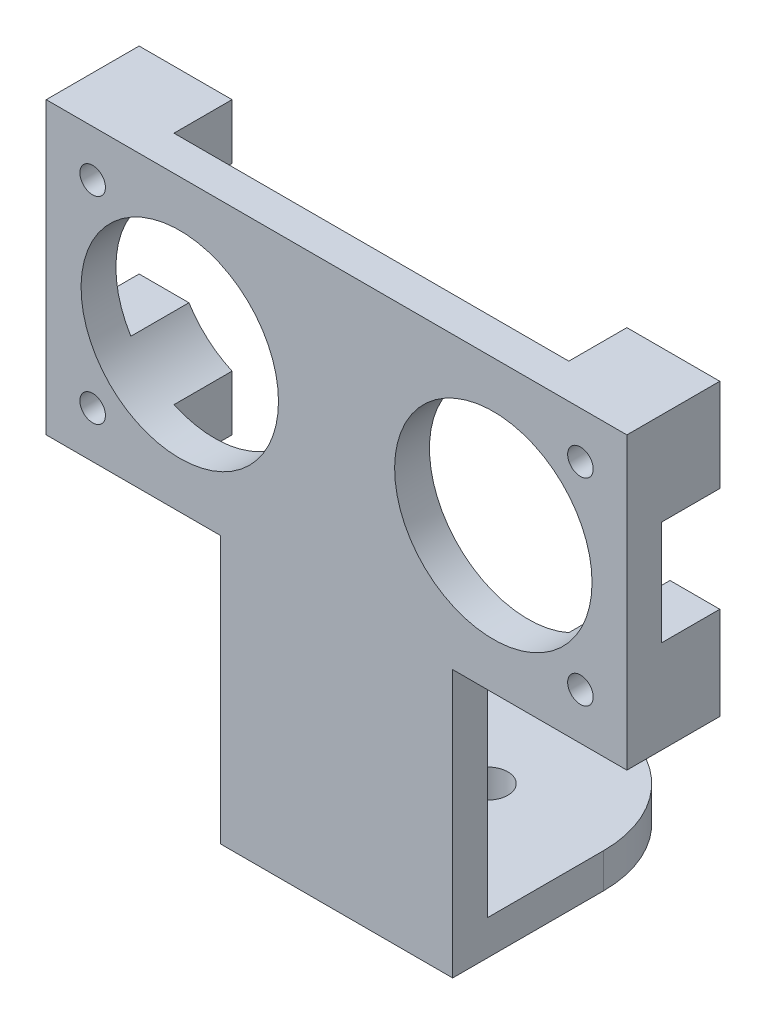
from build123d import *
from build123d.topology import SkipClean

# Parameters (mm, degrees)
SKETCH_1_R      = 8.5
SKETCH_1_R_2    = 1.1
EXTRUDE_1_DEPTH = 3
SKETCH_2_R      = 1.75
EXTRUDE_2_DEPTH = 3
EXTRUDE_START   = 5
SKETCH_5_R      = 1.1
EXTRUDE_3_DEPTH = 5


with BuildPart() as part:
    # 草图1 → 凸台-拉伸1 (new body)
    with BuildSketch(Plane.XY):
        Polygon((-25, 12.5), (25, 12.5), (25, -12.5), (10, -12.5), (10, -32.5), (-10, -32.5), (-10, -12.5), (-25, -12.5), align=None)
        with Locations((-13.5, 0)):
            Circle(SKETCH_1_R, mode=Mode.SUBTRACT)
        with Locations((13.5, 0)):
            Circle(SKETCH_1_R, mode=Mode.SUBTRACT)
        with Locations((-21, 8.5)):
            Circle(SKETCH_1_R_2, mode=Mode.SUBTRACT)
        with Locations((21, 8.5)):
            Circle(SKETCH_1_R_2, mode=Mode.SUBTRACT)
        with Locations((21, -8.5)):
            Circle(SKETCH_1_R_2, mode=Mode.SUBTRACT)
        with Locations((-21, -8.5)):
            Circle(SKETCH_1_R_2, mode=Mode.SUBTRACT)
    extrude(amount=EXTRUDE_1_DEPTH)

    # 草图2 → 凸台-拉伸2 (add)
    with BuildSketch(Plane.XZ.offset(32.5)):
        with BuildLine():
            Line((-10, 3), (-10, -10))
            ThreePointArc((-10, -10), (0, -20), (10, -10))
            Line((10, -10), (10, 3))
            Line((10, 3), (-10, 3))
        make_face()
        with Locations((0, -10)):
            Circle(SKETCH_2_R, mode=Mode.SUBTRACT)
    extrude(amount=EXTRUDE_2_DEPTH)

    # 草图5 → 凸台-拉伸3 (add)
    # profile 1 of 4: a face of its own
    with SkipClean():  # the faces are left unmerged after this step: merging them gives an invalid solid
        with BuildSketch(Plane(origin=(0, 0, 0), x_dir=(-1, 0, 0), z_dir=(0, 0, -1)).offset(EXTRUDE_START)):
            with BuildLine():
                Line((-25, 12.5), (-17, 12.5))
                Line((-17, 12.5), (-17, 7.745966692))
                ThreePointArc((-17, 7.745966692), (-19.096070443, 6.397968083), (-20.711102551, 4.5))
                Line((-20.711102551, 4.5), (-25, 4.5))
                Line((-25, 4.5), (-25, 12.5))
            make_face()
            with Locations((-21, 8.5)):
                Circle(SKETCH_5_R, mode=Mode.SUBTRACT)
        # profile 2 of 4: a face of its own
        with BuildSketch(Plane(origin=(0, 0, 0), x_dir=(-1, 0, 0), z_dir=(0, 0, -1)).offset(EXTRUDE_START)):
            with BuildLine():
                Line((-25, -12.5), (-17, -12.5))
                Line((-17, -12.5), (-17, -7.745966692))
                ThreePointArc((-17, -7.745966692), (-19.096070443, -6.397968083), (-20.711102551, -4.5))
                Line((-20.711102551, -4.5), (-25, -4.5))
                Line((-25, -4.5), (-25, -12.5))
            make_face()
            with Locations((-21, -8.5)):
                Circle(SKETCH_5_R, mode=Mode.SUBTRACT)
        # profile 3 of 4: a face of its own
        with BuildSketch(Plane(origin=(0, 0, 0), x_dir=(-1, 0, 0), z_dir=(0, 0, -1)).offset(EXTRUDE_START)):
            with BuildLine():
                Line((25, 12.5), (17, 12.5))
                Line((17, 12.5), (17, 7.745966692))
                ThreePointArc((17, 7.745966692), (19.096070443, 6.397968083), (20.711102551, 4.5))
                Line((20.711102551, 4.5), (25, 4.5))
                Line((25, 4.5), (25, 12.5))
            make_face()
            with Locations((21, 8.5)):
                Circle(SKETCH_5_R, mode=Mode.SUBTRACT)
        # profile 4 of 4: a face of its own
        with BuildSketch(Plane(origin=(0, 0, 0), x_dir=(-1, 0, 0), z_dir=(0, 0, -1)).offset(EXTRUDE_START)):
            with BuildLine():
                Line((25, -12.5), (17, -12.5))
                Line((17, -12.5), (17, -7.745966692))
                ThreePointArc((17, -7.745966692), (19.096070443, -6.397968083), (20.711102551, -4.5))
                Line((20.711102551, -4.5), (25, -4.5))
                Line((25, -4.5), (25, -12.5))
            make_face()
            with Locations((21, -8.5)):
                Circle(SKETCH_5_R, mode=Mode.SUBTRACT)
        extrude(amount=-EXTRUDE_3_DEPTH)


solid = part.part
